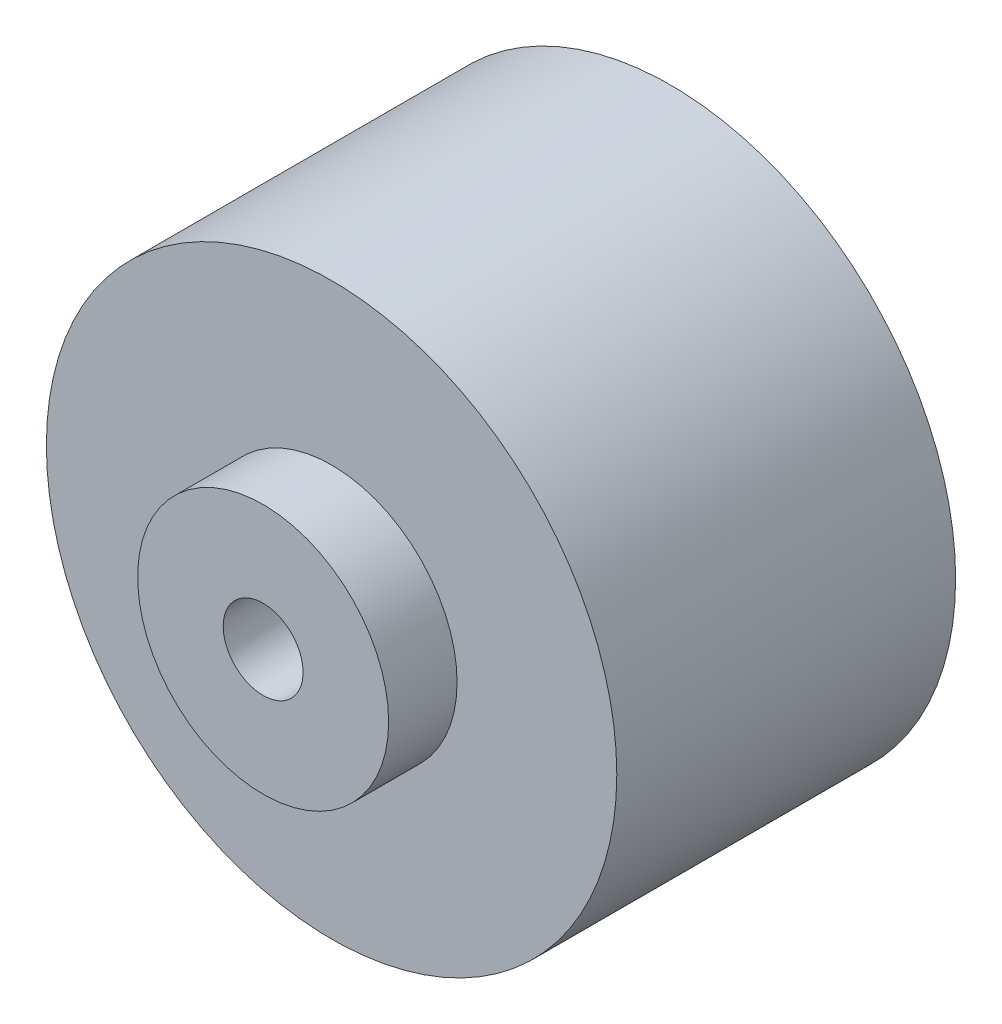
from build123d import *

# Parameters (mm, degrees)
SKETCH1_R           = 25
BOSS_EXTRUDE1_DEPTH = 29.7
SKETCH2_R           = 11
BOSS_EXTRUDE2_DEPTH = 6
SKETCH3_R           = 12.25
BOSS_EXTRUDE3_DEPTH = 9
SKETCH4_R           = 3.5
CUT_EXTRUDE1_DEPTH  = 57.992016985


with BuildPart() as part:
    # Sketch1 → Boss-Extrude1 (new body)
    with BuildSketch(Plane.XY):
        Circle(SKETCH1_R)
    extrude(amount=BOSS_EXTRUDE1_DEPTH)

    # Sketch2 → Boss-Extrude2 (add)
    with BuildSketch(Plane.XY.offset(29.7)):
        Circle(SKETCH2_R)
    extrude(amount=BOSS_EXTRUDE2_DEPTH)

    # Sketch3 → Boss-Extrude3 (add)
    with BuildSketch(Plane(origin=(0, 0, 0), x_dir=(-1, 0, 0), z_dir=(0, 0, -1))):
        Circle(SKETCH3_R)
    extrude(amount=BOSS_EXTRUDE3_DEPTH)

    # Sketch4 → Cut-Extrude1 (cut, through all)
    with BuildSketch(Plane(origin=(0, 0, -9), x_dir=(-1, 0, 0), z_dir=(0, 0, -1))):
        Circle(SKETCH4_R)
    extrude(amount=-CUT_EXTRUDE1_DEPTH, mode=Mode.SUBTRACT)


solid = part.part
